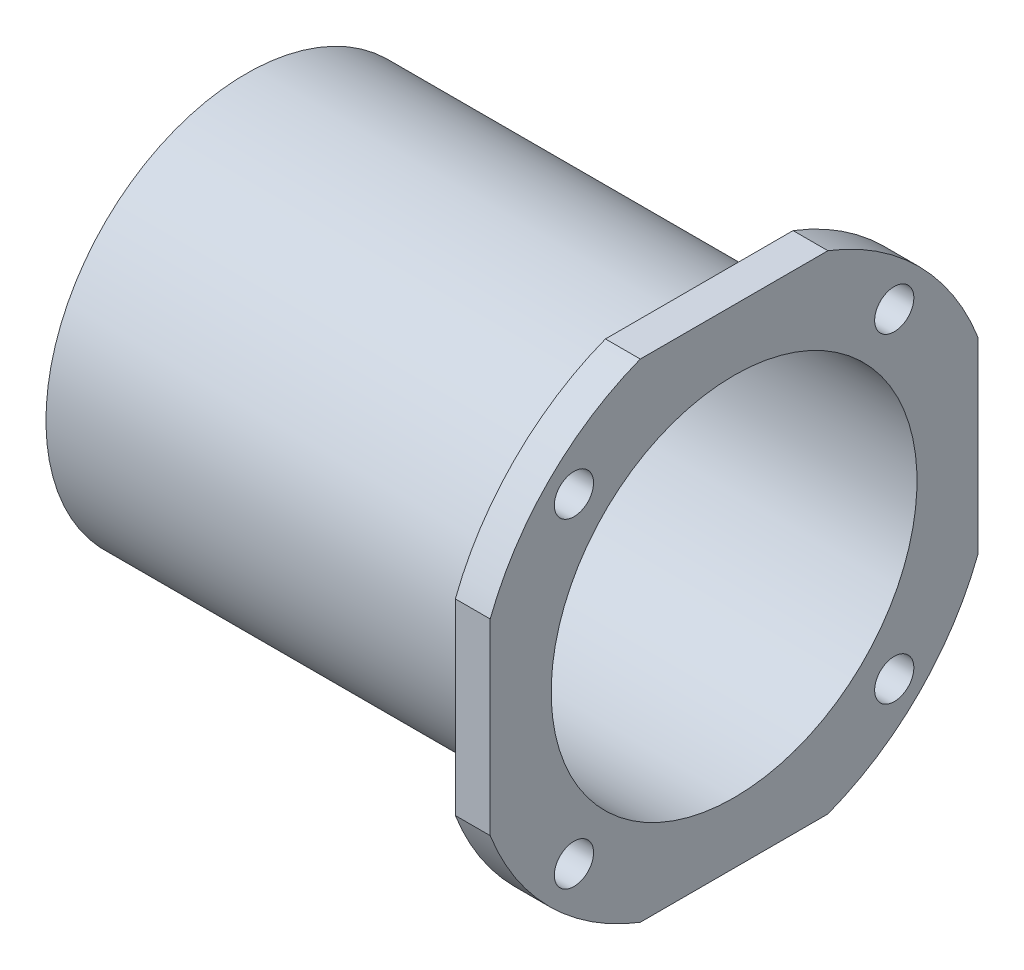
from build123d import *

# Parameters (mm, degrees)
HOLE_WIZARD_2_AT_2_COUNT = 2
HOLE_WIZARD_2_AT_2_PITCH = 24.748737342
HOLE_WIZARD_2_AT_3_COUNT = 2
HOLE_WIZARD_2_AT_3_PITCH = 35
HOLE_WIZARD_2_AT_4_COUNT = 2
HOLE_WIZARD_2_AT_4_PITCH = 24.748737342
SKETCH_18_OUTSIDE_W      = 82.334
SKETCH_18_OUTSIDE_H      = 82.334
SKETCH_18_OUTSIDE_W_2    = 56
SKETCH_18_OUTSIDE_H_2    = 56
CUT_EXTRUDE_3_DEPTH      = 4
HOLE_WIZARD_M4_1_D       = 4.5


with BuildPart() as part:
    # 草图1 → 旋转2 (revolve)
    with BuildSketch(Plane.XY, mode=Mode.PRIVATE) as revolve_2_sk:
        Polygon((52, 23), (52, 30), (56, 30), (56, 21), (5, 21), (5, 14), (0, 14), (0, 23), align=None)
    revolve(revolve_2_sk.sketch.rotate(Axis((0, 0, 0), (1, 0, 0)), 180), axis=Axis((0, 0, 0), (1, 0, 0)))

    # 草图10 → 打孔尺寸根据十字槽沉头木螺钉的类型2 (revolve, cut)
    with BuildSketch(Plane(origin=(0, 0, 17.5), x_dir=(0, 0, 1), z_dir=(0, 1, 0))):
        Polygon((0, 0), (0, 56), (2.25, 56), (2.25, 2.55), (4.3, 0.5), (4.3, 0), align=None)
    hole_wizard_2 = revolve(axis=Axis((-6.35, 0, 17.5), (1, 0, 0)), mode=Mode.SUBTRACT)

    # 打孔尺寸根据十字槽沉头木螺钉的类型2 at 2: 打孔尺寸根据十字槽沉头木螺钉的类型2 ×2
    with Locations(*[Vector(0, -0.7071067811865575, -0.7071067811865376) * (i * HOLE_WIZARD_2_AT_2_PITCH) for i in range(1, HOLE_WIZARD_2_AT_2_COUNT)]):
        add(hole_wizard_2, mode=Mode.SUBTRACT)

    # 打孔尺寸根据十字槽沉头木螺钉的类型2 at 3: 打孔尺寸根据十字槽沉头木螺钉的类型2 ×2
    with Locations(*[(0, 0, -i * HOLE_WIZARD_2_AT_3_PITCH) for i in range(1, HOLE_WIZARD_2_AT_3_COUNT)]):
        add(hole_wizard_2, mode=Mode.SUBTRACT)

    # 打孔尺寸根据十字槽沉头木螺钉的类型2 at 4: 打孔尺寸根据十字槽沉头木螺钉的类型2 ×2
    with Locations(*[Vector(0, 0.7071067811865376, -0.7071067811865575) * (i * HOLE_WIZARD_2_AT_4_PITCH) for i in range(1, HOLE_WIZARD_2_AT_4_COUNT)]):
        add(hole_wizard_2, mode=Mode.SUBTRACT)

    # 草图18 outside → 切除-拉伸3 (cut)
    with BuildSketch(Plane(origin=(56, 0, 0), x_dir=(0, 0, -1), z_dir=(1, 0, 0))):
        Rectangle(SKETCH_18_OUTSIDE_W, SKETCH_18_OUTSIDE_H)
        Rectangle(SKETCH_18_OUTSIDE_W_2, SKETCH_18_OUTSIDE_H_2, mode=Mode.SUBTRACT)
    extrude(amount=-CUT_EXTRUDE_3_DEPTH, mode=Mode.SUBTRACT)

    # M4 间隙孔1 (through all)
    with Locations(Plane(origin=(56, 0, 0), x_dir=(0, 0, -1), z_dir=(1, 0, 0))):
        with Locations((18.384776311, 18.384776311), (18.384776311, -18.384776311), (-18.384776311, -18.384776311), (-18.384776311, 18.384776311)):
            Hole(HOLE_WIZARD_M4_1_D / 2)


solid = part.part
